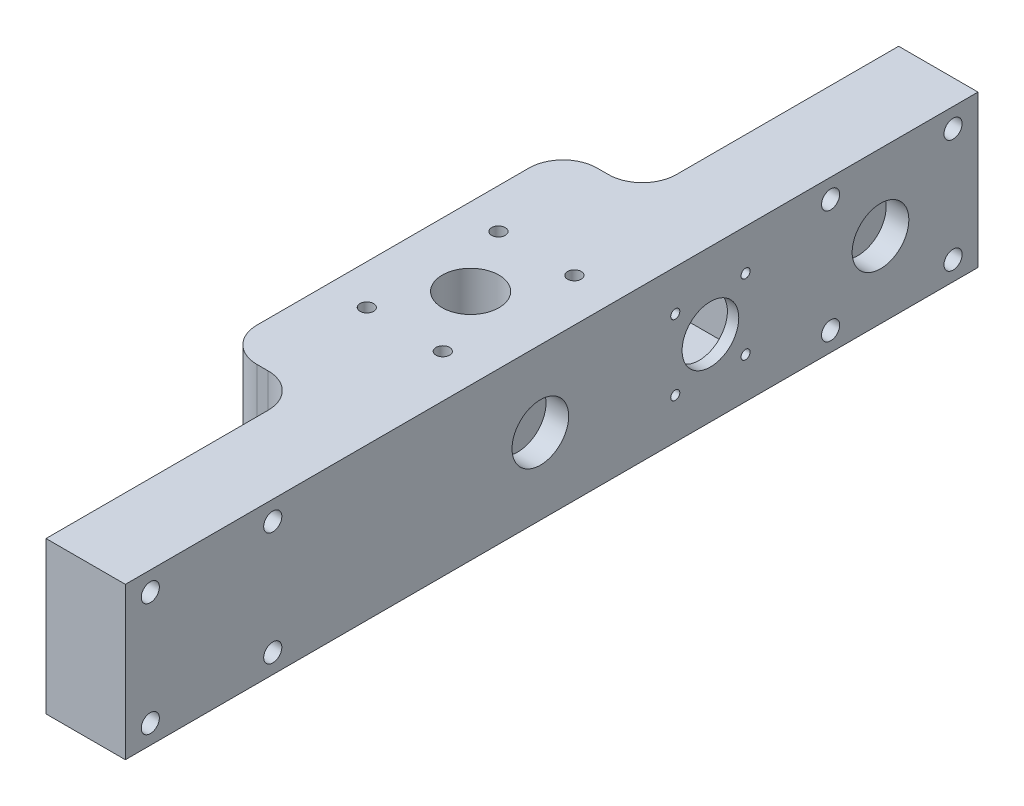
from build123d import *

# Parameters (mm, degrees)
SKETCH1_R           = 12.5
SKETCH1_R_2         = 3
BOSS_EXTRUDE1_DEPTH = 67
SKETCH2_R           = 4
CUT_EXTRUDE1_DEPTH  = 212.501773042
FILLET1_R           = 15
CUT_EXTRUDE3_REACH  = 218.502
CUT_EXTRUDE3_START  = -5
SKETCH3_W           = 45
SKETCH3_H           = 45
SKETCH3_R           = 2
SKETCH3_R_2         = 12.5
SKETCH3_2_R         = 2
SKETCH3_2_R_2       = 12.5
CUT_EXTRUDE4_DEPTH  = 212.501773075
SKETCH3_4_R         = 12.5
CUT_EXTRUDE5_DEPTH  = 10


with BuildPart() as part:
    # Sketch1 → Boss-Extrude1 (new body)
    with BuildSketch(Plane(origin=(0, 0, 0), x_dir=(1, 0, 0), z_dir=(0, 1, 0))):
        Polygon((0.75, -188), (35.75, -188), (35.75, 188), (0.75, 188), (0.75, 75), (-34.25, 75), (-34.25, -75), (0.75, -75), align=None)
        with Locations(Location((0, 0, 0), (0, 0, 270))):
            Circle(SKETCH1_R, mode=Mode.SUBTRACT)
        with Locations(Location((-16.75, -29.011851027, 0), (0, 0, 270))):
            Circle(SKETCH1_R_2, mode=Mode.SUBTRACT)
        with Locations(Location((16.75, -29.011851027, 0), (0, 0, 270))):
            Circle(SKETCH1_R_2, mode=Mode.SUBTRACT)
        with Locations(Location((16.75, 29.011851027, 0), (0, 0, 270))):
            Circle(SKETCH1_R_2, mode=Mode.SUBTRACT)
        with Locations(Location((-16.75, 29.011851027, 0), (0, 0, 270))):
            Circle(SKETCH1_R_2, mode=Mode.SUBTRACT)
    extrude(amount=BOSS_EXTRUDE1_DEPTH)

    # Sketch2 → Cut-Extrude1 (cut, through all)
    with BuildSketch(Plane(origin=(35.75, 0, 0), x_dir=(0, 0, -1), z_dir=(1, 0, 0))):
        with Locations((-177, 58.5)):
            Circle(SKETCH2_R)
        with Locations((-123, 58.5)):
            Circle(SKETCH2_R)
        with Locations((-177, 8.5)):
            Circle(SKETCH2_R)
        with Locations((-123, 8.5)):
            Circle(SKETCH2_R)
        with Locations((177, 58.5)):
            Circle(SKETCH2_R)
        with Locations((177, 8.5)):
            Circle(SKETCH2_R)
        with Locations((123, 8.5)):
            Circle(SKETCH2_R)
        with Locations((123, 58.5)):
            Circle(SKETCH2_R)
    extrude(amount=-CUT_EXTRUDE1_DEPTH, mode=Mode.SUBTRACT)

    # Fillet1
    fillet1_edges = [part.edges().sort_by_distance(p)[0] for p in [
        (0.75, 33.5, 75),
        (-34.25, 33.5, 75),
        (-34.25, 33.5, -75),
        (0.75, 33.5, -75),
    ]]
    fillet(fillet1_edges, radius=FILLET1_R)

    # Cut-Extrude3: up to this face of the body (flat: up to its plane)
    cut_extrude3_end = Plane(part.part.faces().sort_by_distance((-34.25, 33.5, 0))[0])
    # Sketch3 → Cut-Extrude3 (cut, up to the picked face)
    with BuildSketch(Plane(origin=(35.75, 0, 0), x_dir=(0, 0, -1), z_dir=(1, 0, 0)).offset(CUT_EXTRUDE3_START), mode=Mode.PRIVATE) as cut_extrude3_sk1:
        with Locations((70, 33.5)):
            Rectangle(SKETCH3_W, SKETCH3_H)
        with Locations((54.5, 49)):
            Circle(SKETCH3_R, mode=Mode.SUBTRACT)
        with Locations((54.5, 18)):
            Circle(SKETCH3_R, mode=Mode.SUBTRACT)
        with Locations((85.5, 18)):
            Circle(SKETCH3_R, mode=Mode.SUBTRACT)
        with Locations((85.5, 49)):
            Circle(SKETCH3_R, mode=Mode.SUBTRACT)
        with Locations((70, 33.5)):
            Circle(SKETCH3_R_2, mode=Mode.SUBTRACT)
    cut_extrude3_tool1 = split(extrude(cut_extrude3_sk1.sketch, amount=-CUT_EXTRUDE3_REACH, mode=Mode.PRIVATE), bisect_by=cut_extrude3_end, keep=Keep.BOTH, mode=Mode.PRIVATE)
    add(cut_extrude3_tool1.solids().sort_by(Axis((30.75, 11.636396, -70), (-1, 0, 0)))[0], mode=Mode.SUBTRACT)

    # Sketch3<2> → Cut-Extrude4 (cut, through all)
    with BuildSketch(Plane(origin=(35.75, 0, 0), x_dir=(0, 0, -1), z_dir=(1, 0, 0))):
        with Locations((54.5, 49)):
            Circle(SKETCH3_2_R)
        with Locations((85.5, 49)):
            Circle(SKETCH3_2_R)
        with Locations((85.5, 18)):
            Circle(SKETCH3_2_R)
        with Locations((54.5, 18)):
            Circle(SKETCH3_2_R)
        with Locations((70, 33.5)):
            Circle(SKETCH3_2_R_2)
    extrude(amount=-CUT_EXTRUDE4_DEPTH, mode=Mode.SUBTRACT)

    # Sketch3<4> → Cut-Extrude5 (cut)
    with BuildSketch(Plane(origin=(35.75, 0, 0), x_dir=(0, 0, -1), z_dir=(1, 0, 0))):
        with Locations((-5, 33.5)):
            Circle(SKETCH3_4_R)
        with Locations((145, 33.5)):
            Circle(SKETCH3_4_R)
    extrude(amount=-CUT_EXTRUDE5_DEPTH, mode=Mode.SUBTRACT)


solid = part.part
